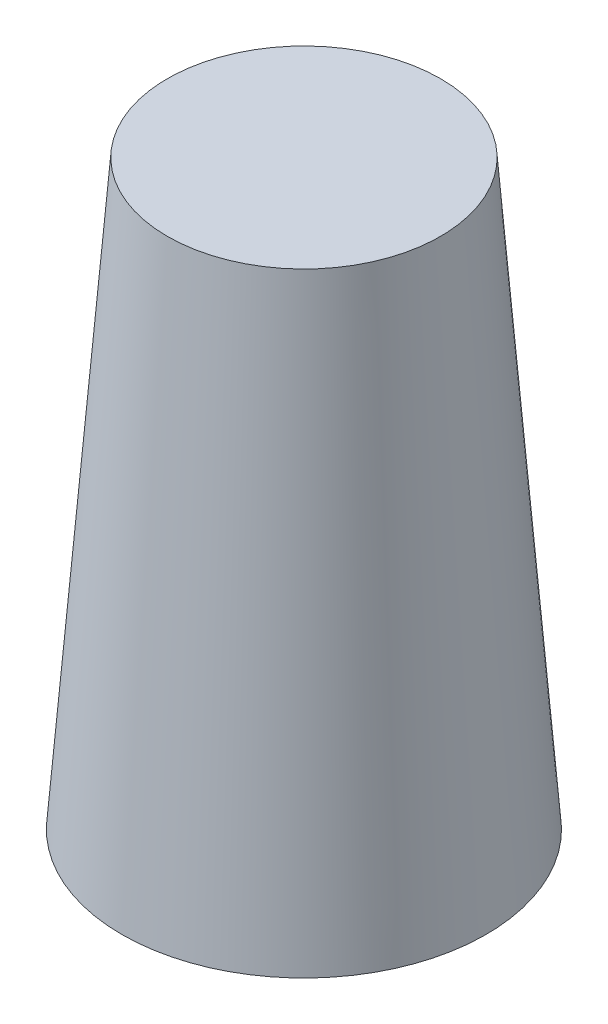
from build123d import *

# Parameters (mm, degrees)
COQUE1_T = -1.5


with BuildPart() as part:
    # Esquisse1 → Révolution1 (revolve)
    with BuildSketch(Plane.XY, mode=Mode.PRIVATE) as r_volution1_sk:
        Polygon((0, 0), (-36, 0), (-27, 115), (0, 115), align=None)
    revolve(r_volution1_sk.sketch.rotate(Axis((0, 115, 0), (0, -1, 0)), 270), axis=Axis((0, 115, 0), (0, -1, 0)))

    # Coque1
    coque1_openings = [part.faces().sort_by_distance(p)[0] for p in [
        (0, 0, 0),
    ]]
    offset(amount=COQUE1_T, openings=coque1_openings, kind=Kind.INTERSECTION)


solid = part.part
